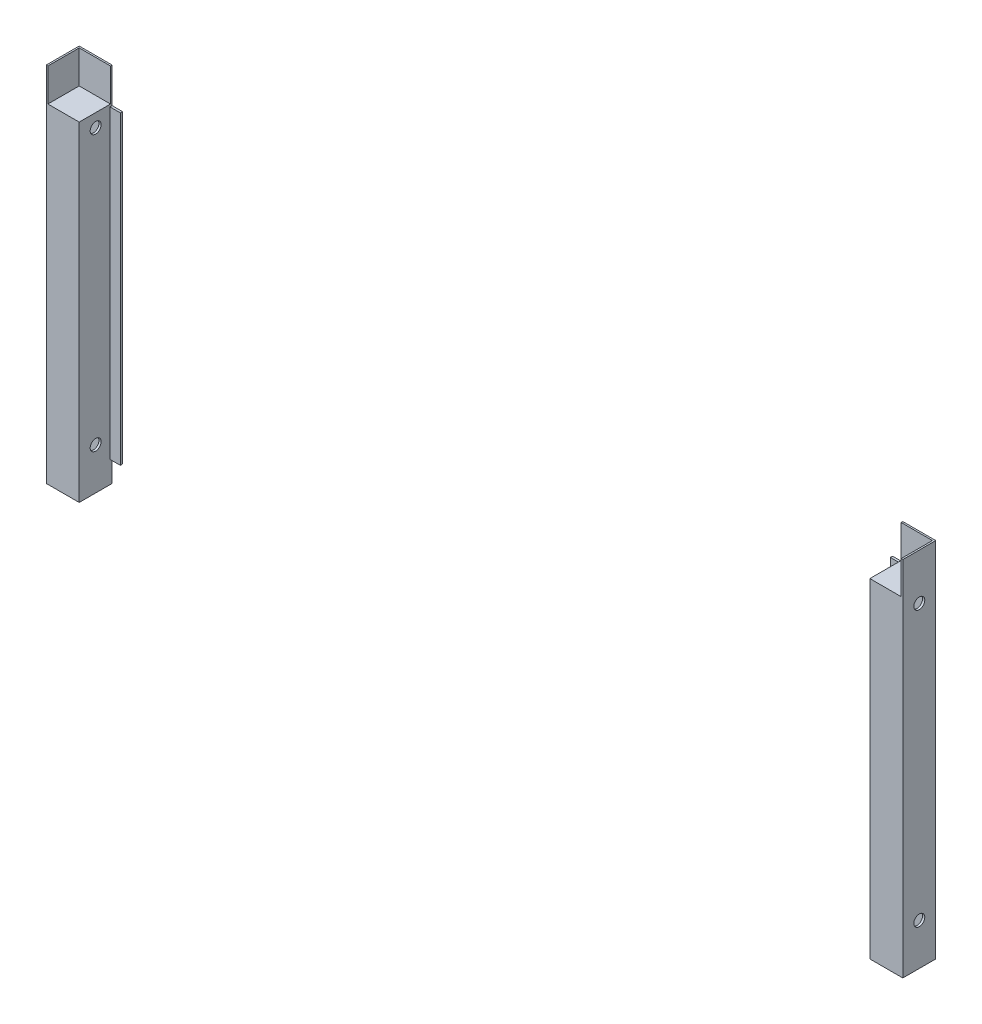
from build123d import *

# Parameters (mm, degrees)
SKETCH1_W           = 30
SKETCH1_H           = 30
BOSS_EXTRUDE1_DEPTH = 300
SHELL1_T            = -2
SKETCH3_W           = 30
SKETCH3_H           = 30
BOSS_EXTRUDE2_DEPTH = 1.5
SKETCH4_W           = 30
SKETCH4_H           = 30
BOSS_EXTRUDE3_DEPTH = 1.5
SKETCH5_R           = 5
CUT_EXTRUDE1_DEPTH  = 332.700165812
BOSS_EXTRUDE4_DEPTH = 278


with BuildPart() as part:
    # Sketch1 → Boss-Extrude1 (new body)
    with BuildSketch(Plane(origin=(0, 0, 0), x_dir=(1, 0, 0), z_dir=(0, 1, 0))):
        Rectangle(SKETCH1_W, SKETCH1_H)
    extrude(amount=BOSS_EXTRUDE1_DEPTH)

    # Shell1
    shell1_openings = [part.faces().sort_by_distance(p)[0] for p in [
        (0, 0, 0),
    ]]
    offset(amount=SHELL1_T, openings=shell1_openings, kind=Kind.INTERSECTION)



with BuildPart() as body_2:
    # Sketch3 → Boss-Extrude2 (new body)
    with BuildSketch(Plane.ZY.offset(15)):
        with Locations((0, 315)):
            Rectangle(SKETCH3_W, SKETCH3_H)
    extrude(amount=-BOSS_EXTRUDE2_DEPTH)


with BuildPart() as part_1:
    add(part.part)

    add(body_2.part)  # Boss-Extrude3 merges body 2
    # Sketch4 → Boss-Extrude3 (add)
    with BuildSketch(Plane(origin=(0, 0, -15), x_dir=(-1, 0, 0), z_dir=(0, 0, -1))):
        with Locations((0, 315)):
            Rectangle(SKETCH4_W, SKETCH4_H)
    extrude(amount=-BOSS_EXTRUDE3_DEPTH)

    # Sketch5 → Cut-Extrude1 (cut, through all)
    with BuildSketch(Plane.ZY.offset(15)):
        with Locations((0, 288)):
            Circle(SKETCH5_R)
        with Locations((0, 38)):
            Circle(SKETCH5_R)
    extrude(amount=-CUT_EXTRUDE1_DEPTH, mode=Mode.SUBTRACT)

    # Sketch7 → Boss-Extrude4 (add)
    with BuildSketch(Plane(origin=(0, 20, 0), x_dir=(-1, 0, 0), z_dir=(0, -1, 0))):
        Polygon((-13, 13), (-13, 15), (-15, 15), (-24.4, 15), (-24.4, 13), align=None)
    extrude(amount=-BOSS_EXTRUDE4_DEPTH)


with BuildPart() as body_2_2:
    # Mirror5: mirrored copy
    add(part_1.part.mirror(Plane.ZY.offset(-375)))


solid = Compound([part_1.part, body_2_2.part])
